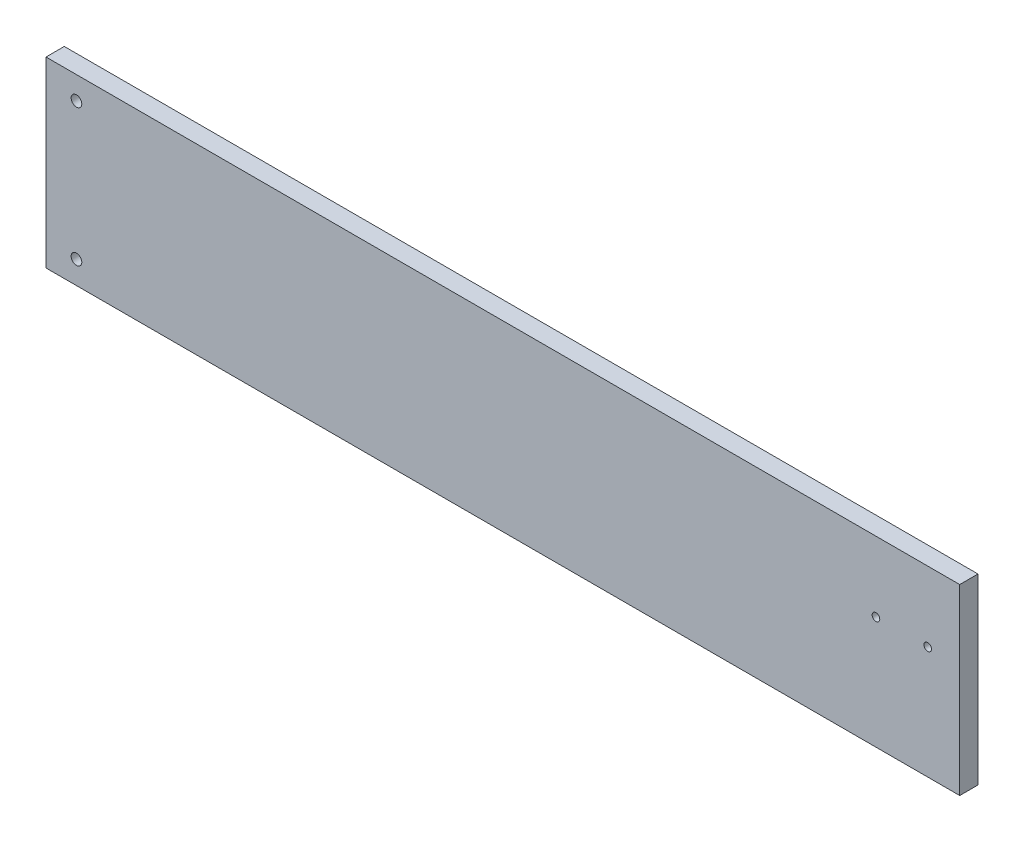
from build123d import *

# Parameters (mm, degrees)
SKETCH_1_W          = 600
SKETCH_1_H          = 120
EXTRUDE_1_DEPTH     = 12
SKETCH_4_R          = 3.5
CUT_EXTRUDE_1_DEPTH = 613
HOLE_WIZARD_M6_1_D  = 5


with BuildPart() as part:
    # 草图1 → 凸台-拉伸1 (new body)
    with BuildSketch(Plane.XY):
        with Locations((300, 60)):
            Rectangle(SKETCH_1_W, SKETCH_1_H)
    extrude(amount=EXTRUDE_1_DEPTH)

    # 草图4 → 切除-拉伸1 (cut, through all)
    with BuildSketch(Plane(origin=(0, 0, 0), x_dir=(-1, 0, 0), z_dir=(0, 0, -1))):
        with Locations((-20, 15)):
            Circle(SKETCH_4_R)
        with Locations(Location((-20, 105, 0), (0, 0, 180))):
            Circle(SKETCH_4_R)
    extrude(amount=-CUT_EXTRUDE_1_DEPTH, mode=Mode.SUBTRACT)

    # M6 螺纹孔1 (through all)
    with Locations(Plane(origin=(0, 0, 0), x_dir=(-1, 0, 0), z_dir=(0, 0, -1))):
        with Locations((-579, 74), (-545, 74)):
            Hole(HOLE_WIZARD_M6_1_D / 2)


solid = part.part
